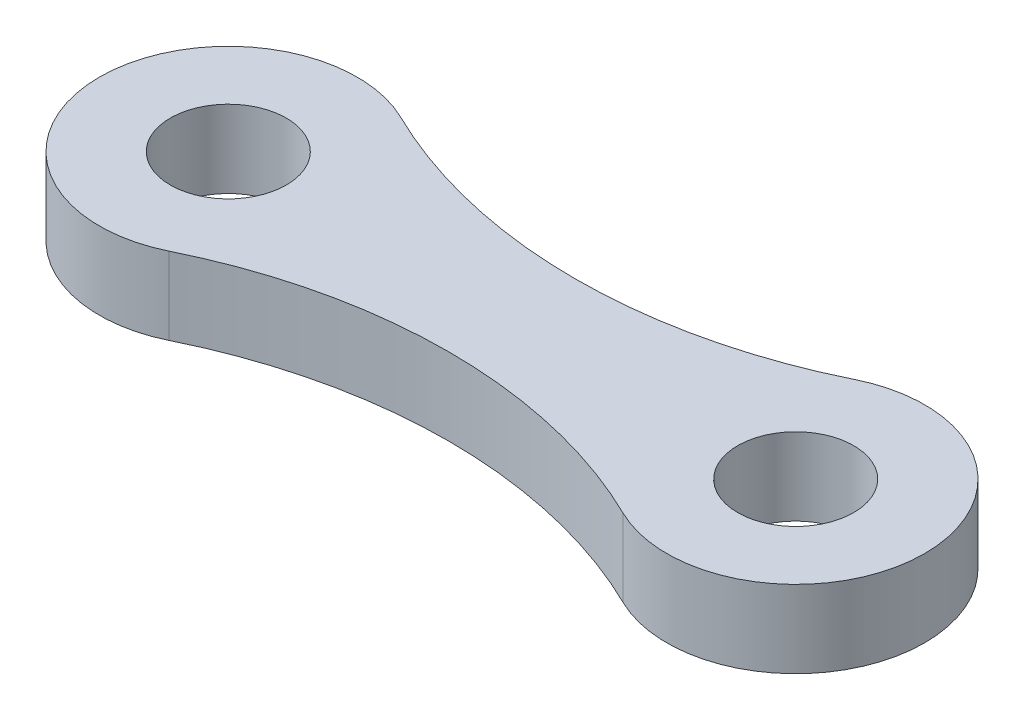
from build123d import *

# Parameters (mm, degrees)
IZIM1_R                     = 1.125
Y_KSEKLIK_EKSTR_ZYON1_DEPTH = 1.5


with BuildPart() as part:
    # Çizim1 → Yükseklik-Ekstrüzyon1 (new body)
    with BuildSketch(Plane(origin=(0, 0, 0), x_dir=(1, 0, 0), z_dir=(0, 1, 0))):
        with BuildLine():
            ThreePointArc((-4.4, 2.244994432), (-8, 0), (-4.4, -2.244994432))
            ThreePointArc((-4.4, -2.244994432), (0, -1.22497216), (4.4, -2.244994432))
            ThreePointArc((4.4, -2.244994432), (8, 0), (4.4, 2.244994432))
            ThreePointArc((4.4, 2.244994432), (0, 1.22497216), (-4.4, 2.244994432))
        make_face()
        with Locations(Location((-5.5, 0, 0), (0, 0, 270))):
            Circle(IZIM1_R, mode=Mode.SUBTRACT)
        with Locations(Location((5.5, 0, 0), (0, 0, 270))):
            Circle(IZIM1_R, mode=Mode.SUBTRACT)
    extrude(amount=Y_KSEKLIK_EKSTR_ZYON1_DEPTH)


solid = part.part
